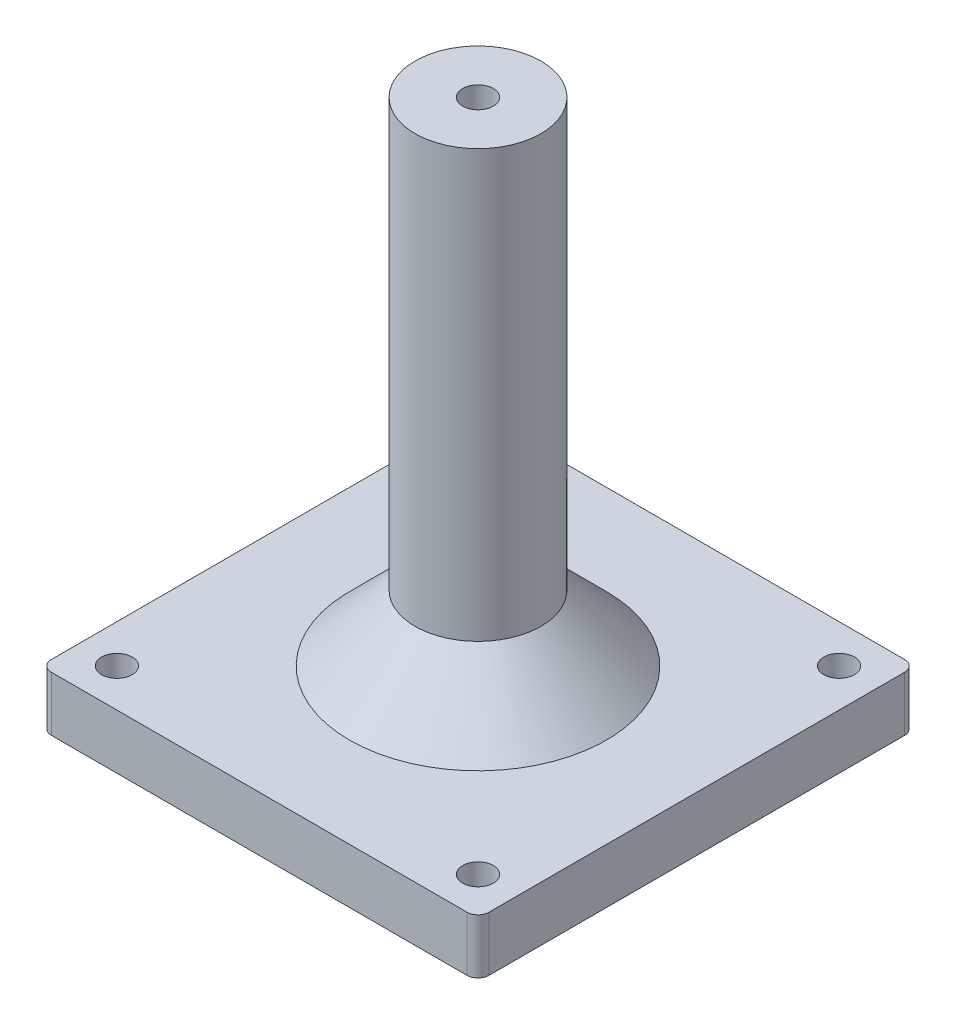
from build123d import *

# Parameters (mm, degrees)
SKETCH1_W           = 40
SKETCH1_H           = 40
BOSS_EXTRUDE1_DEPTH = 5
SKETCH3_R           = 1.4
CUT_EXTRUDE1_DEPTH  = 10
SKETCH4_R           = 5.75
BOSS_EXTRUDE2_DEPTH = 45
CHAMFER1_SIZE       = 6
SKETCH6_R           = 1.4
CUT_EXTRUDE2_DEPTH  = 16
FILLET1_R           = 1


with BuildPart() as part:
    # Sketch1 → Boss-Extrude1 (new body)
    with BuildSketch(Plane(origin=(0, 0, 0), x_dir=(1, 0, 0), z_dir=(0, 1, 0))):
        Rectangle(SKETCH1_W, SKETCH1_H)
    extrude(amount=BOSS_EXTRUDE1_DEPTH)

    # Sketch3 → Cut-Extrude1 (cut)
    with BuildSketch(Plane.XZ):
        with Locations(Location((-16.5, -16.5, 0), (0, 0, 270))):
            Circle(SKETCH3_R)
        with Locations(Location((-16.5, 16.5, 0), (0, 0, 270))):
            Circle(SKETCH3_R)
        with Locations(Location((16.5, 16.5, 0), (0, 0, 270))):
            Circle(SKETCH3_R)
        with Locations(Location((16.5, -16.5, 0), (0, 0, 270))):
            Circle(SKETCH3_R)
    extrude(amount=-CUT_EXTRUDE1_DEPTH, mode=Mode.SUBTRACT)

    # Sketch4 → Boss-Extrude2 (add)
    with BuildSketch(Plane(origin=(0, 5, 0), x_dir=(1, 0, 0), z_dir=(0, 1, 0))):
        with Locations(Location((0, 0, 0), (0, 0, 90))):
            Circle(SKETCH4_R)
    extrude(amount=BOSS_EXTRUDE2_DEPTH)

    # Chamfer1
    chamfer1_edges = [part.edges().sort_by_distance(p)[0] for p in [
        (0, 5, 5.75),
    ]]
    chamfer(chamfer1_edges, length=CHAMFER1_SIZE)

    # Sketch6 → Cut-Extrude2 (cut)
    with BuildSketch(Plane(origin=(0, 50, 0), x_dir=(1, 0, 0), z_dir=(0, 1, 0))):
        with Locations(Location((0, 0, 0), (0, 0, 270))):
            Circle(SKETCH6_R)
    extrude(amount=-CUT_EXTRUDE2_DEPTH, mode=Mode.SUBTRACT)

    # Fillet1
    fillet1_edges = [part.edges().sort_by_distance(p)[0] for p in [
        (20, 2.5, 20),
        (-20, 2.5, 20),
        (-20, 2.5, -20),
        (20, 2.5, -20),
    ]]
    fillet(fillet1_edges, radius=FILLET1_R)


solid = part.part
